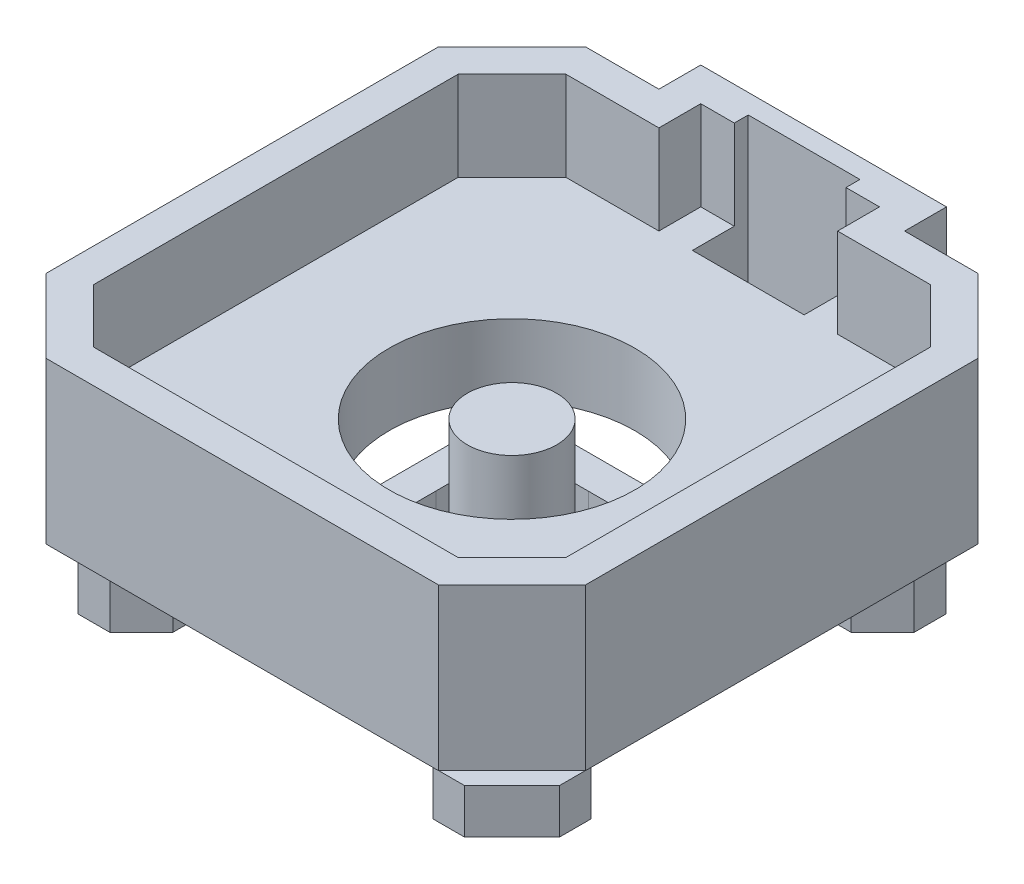
from build123d import *

# Parameters (mm, degrees)
BOSS_EXTRUDE1_DEPTH = 8
BOSS_EXTRUDE2_DEPTH = 6.4
SKETCH4_R           = 11
CUT_EXTRUDE1_DEPTH  = 13
SKETCH5_R           = 4
BOSS_EXTRUDE3_DEPTH = 13
SKETCH6_R           = 1.5
BOSS_EXTRUDE4_DEPTH = 4
CIRPATTERN2_COUNT   = 4
SKETCH8_W           = 10
SKETCH8_H           = 5
CUT_EXTRUDE2_DEPTH  = 19


with BuildPart() as part:
    # Sketch1 → Boss-Extrude1 (new body)
    with BuildSketch(Plane.XZ.offset(-16.312689454)):
        Polygon((-42.346407377, 51.389271206), (-42.346407377, 16.250671026), (-35.765707467, 9.669971116), (-29.196407377, 9.669971116), (-29.196407377, 5.919971116), (-7.196407377, 5.919971116), (-7.196407377, 9.669971116), (-0.627107287, 9.669971116), (5.953592623, 16.250671026), (5.953592623, 51.389271206), (-0.627107287, 57.969971116), (-35.765707467, 57.969971116), align=None)
        Polygon((-10.196407377, 12.669971116), (-1.869747974, 12.669971116), (2.953592623, 17.493311713), (2.953592623, 50.146630519), (-1.869747974, 54.969971116), (-34.52306678, 54.969971116), (-39.346407377, 50.146630519), (-39.346407377, 17.493311713), (-34.52306678, 12.669971116), (-26.196407377, 12.669971116), (-26.196407377, 8.919971116), (-10.196407377, 8.919971116), align=None, mode=Mode.SUBTRACT)
    extrude(amount=-BOSS_EXTRUDE1_DEPTH)

    # Sketch3 → Boss-Extrude2 (add)
    with BuildSketch(Plane.XZ.offset(-16.312689454)):
        Polygon((-35.765707467, 57.969971116), (-42.346407377, 51.389271206), (-42.346407377, 16.250671026), (-35.765707467, 9.669971116), (-29.196407377, 9.669971116), (-29.196407377, 5.919971116), (-7.196407377, 5.919971116), (-7.196407377, 9.669971116), (-0.627107287, 9.669971116), (5.953592623, 16.250671026), (5.953592623, 51.389271206), (-0.627107287, 57.969971116), align=None)
    extrude(amount=BOSS_EXTRUDE2_DEPTH)

    # Sketch4 → Cut-Extrude1 (cut)
    with BuildSketch(Plane.XZ.offset(-9.912689454)):
        with Locations(Location((-18.196407377, 33.819971116, 0), (0, 0, 270))):
            Circle(SKETCH4_R)
    extrude(amount=-CUT_EXTRUDE1_DEPTH, mode=Mode.SUBTRACT)

    # Sketch8 → Cut-Extrude2 (cut)
    with BuildSketch(Plane(origin=(0, 24.312689454, 0), x_dir=(1, 0, 0), z_dir=(0, 1, 0))):
        with Locations((-18.196407377, -10.169971116)):
            Rectangle(SKETCH8_W, SKETCH8_H)
    extrude(amount=-CUT_EXTRUDE2_DEPTH, mode=Mode.SUBTRACT)


with BuildPart() as body_2:
    # Sketch5 → Boss-Extrude3 (new body)
    with BuildSketch(Plane.XZ.offset(-16.312689454)):
        with Locations(Location((-18.196407377, 33.819971116, 0), (0, 0, 270))):
            Circle(SKETCH5_R)
    extrude(amount=BOSS_EXTRUDE3_DEPTH)

    # Sketch6 → Boss-Extrude4 (add)
    with BuildSketch(Plane.XZ.offset(-3.312689454)):
        with BuildLine():
            Line((-22.060110682, 34.855247296), (-25.022114558, 37.817251172))
            Line((-25.022114558, 37.817251172), (-25.022114558, 33.819971116))
            Line((-25.022114558, 33.819971116), (-28.024834502, 33.819971116))
            Line((-28.024834502, 33.819971116), (-28.024834502, 40.819971116))
            Line((-28.024834502, 40.819971116), (-33.373819181, 46.168955795))
            Line((-33.373819181, 46.168955795), (-34.080925962, 45.461849014))
            Line((-34.080925962, 45.461849014), (-36.909353087, 45.461849014))
            Line((-36.909353087, 45.461849014), (-39.737780212, 48.290276139))
            Line((-39.737780212, 48.290276139), (-39.737780212, 51.118703264))
            Line((-39.737780212, 51.118703264), (-35.495139525, 55.361343951))
            Line((-35.495139525, 55.361343951), (-32.6667124, 55.361343951))
            Line((-32.6667124, 55.361343951), (-29.838285275, 52.532916826))
            Line((-29.838285275, 52.532916826), (-29.838285275, 49.704489701))
            Line((-29.838285275, 49.704489701), (-30.545392056, 48.99738292))
            Line((-30.545392056, 48.99738292), (-25.196407377, 43.648398241))
            Line((-25.196407377, 43.648398241), (-18.196407377, 43.648398241))
            Line((-18.196407377, 43.648398241), (-18.196407377, 40.648398241))
            Line((-18.196407377, 40.648398241), (-22.196407377, 40.648398241))
            Line((-22.196407377, 40.648398241), (-19.231683557, 37.683674421))
            ThreePointArc((-19.231683557, 37.683674421), (-21.024834502, 36.648398241), (-22.060110682, 34.855247296))
        make_face()
        with Locations(Location((-34.788032743, 50.411596482, 0), (0, 0, 270))):
            Circle(SKETCH6_R, mode=Mode.SUBTRACT)
    boss_extrude4 = extrude(amount=-BOSS_EXTRUDE4_DEPTH)

    # CirPattern2: Boss-Extrude4 ×4 about axis
    cirpattern2_axis = Axis((-18.196407377, 0, 33.819971116), (0, 1, 0))
    for i in range(1, CIRPATTERN2_COUNT):
        add(boss_extrude4.rotate(cirpattern2_axis, i * 360 / CIRPATTERN2_COUNT))


solid = Compound([part.part, body_2.part])
